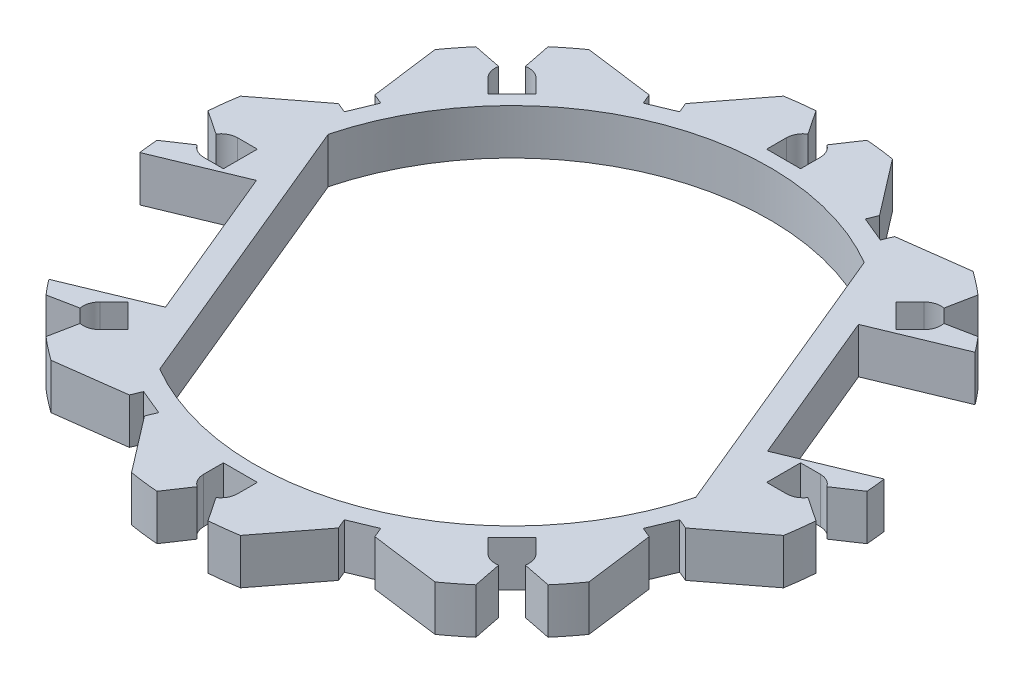
from build123d import *

# Parameters (mm, degrees)
SKETCH1_R           = 54.55
BOSS_EXTRUDE1_DEPTH = 7.5
SKETCH2_R           = 42.5
CUT_EXTRUDE1_DEPTH  = 78.509063986
CUT_EXTRUDE2_DEPTH  = 78.509063986
CUT_EXTRUDE6_DEPTH  = 78.509063986
CIRPATTERN1_COUNT   = 8
CIRPATTERN2_COUNT   = 8
CUT_EXTRUDE7_DEPTH  = 78.279736538
BOSS_EXTRUDE2_DEPTH = 7.5


with BuildPart() as part:
    # Sketch1 → Boss-Extrude1 (new body)
    with BuildSketch(Plane(origin=(0, 0, 0), x_dir=(1, 0, 0), z_dir=(0, 1, 0))):
        with Locations(Location((0, 0, 0), (0, 0, 270))):
            Circle(SKETCH1_R)
    extrude(amount=BOSS_EXTRUDE1_DEPTH)

    # Sketch2 → Cut-Extrude1 (cut, through all)
    with BuildSketch(Plane(origin=(0, 7.5, 0), x_dir=(1, 0, 0), z_dir=(0, 1, 0))):
        with Locations(Location((0, 0, 0), (0, 0, 270))):
            Circle(SKETCH2_R)
    extrude(amount=-CUT_EXTRUDE1_DEPTH, mode=Mode.SUBTRACT)

    # Sketch3 → Cut-Extrude2 (cut, through all)
    with BuildSketch(Plane(origin=(0, 7.5, 0), x_dir=(1, 0, 0), z_dir=(0, 1, 0))):
        with BuildLine():
            Line((-2.8, -48.082), (-2.8, -44.832))
            Line((-2.8, -44.832), (2.8, -44.832))
            Line((2.8, -44.832), (2.8, -48.082))
            ThreePointArc((2.8, -48.082), (2.46937954, -49.401910863), (1.555596652, -50.410114914))
            Line((1.555596652, -50.410114914), (4.212915889, -54.387074197))
            ThreePointArc((4.212915889, -54.387074197), (0, -54.55), (-4.212915889, -54.387074197))
            Line((-4.212915889, -54.387074197), (-1.555596652, -50.410114914))
            ThreePointArc((-1.555596652, -50.410114914), (-2.46937954, -49.401910863), (-2.8, -48.082))
        make_face()
    cut_extrude2 = extrude(amount=-CUT_EXTRUDE2_DEPTH, mode=Mode.SUBTRACT)

    # Sketch9 → Cut-Extrude6 (cut, through all)
    with BuildSketch(Plane(origin=(0, 7.5, 0), x_dir=(1, 0, 0), z_dir=(0, 1, 0))):
        with BuildLine():
            Line((-20.257229317, -42.895088115), (-31.690865911, -44.400354929))
            ThreePointArc((-31.690865911, -44.400354929), (-20.875381236, -50.397628498), (-8.98696587, -53.804618245))
            Line((-8.98696587, -53.804618245), (-16.007383468, -44.655431904))
            Line((-16.007383468, -44.655431904), (-15.318553289, -42.992448745))
            Line((-15.318553289, -42.992448745), (-19.568399139, -41.232104956))
            Line((-19.568399139, -41.232104956), (-20.257229317, -42.895088115))
        make_face()
    cut_extrude6 = extrude(amount=-CUT_EXTRUDE6_DEPTH, mode=Mode.SUBTRACT)

    # CirPattern1: Cut-Extrude2 ×8 about axis
    cirpattern1_axis = Axis((0, 0, 0), (0, 1, 0))
    for i in range(1, CIRPATTERN1_COUNT):
        add(cut_extrude2.rotate(cirpattern1_axis, i * 360 / CIRPATTERN1_COUNT), mode=Mode.SUBTRACT)

    # CirPattern2: Cut-Extrude6 ×8 about axis, 2 skipped
    cirpattern2_axis = Axis((0, 10.872185225, 0), (0, -1, 0))
    add([cut_extrude6.rotate(cirpattern2_axis, i * 360 / CIRPATTERN2_COUNT) for i in range(1, CIRPATTERN2_COUNT) if i not in (1, 5)], mode=Mode.SUBTRACT)

    # Sketch10 → Cut-Extrude7 (cut, through all)
    with BuildSketch(Plane.XZ):
        Polygon((-42.422842704, 2.559768914), (-31.807509711, 28.187449796), (-46.056303911, 34.089493601), (-56.671636904, 8.461812719), align=None)
    cut_extrude7 = extrude(amount=-CUT_EXTRUDE7_DEPTH, mode=Mode.SUBTRACT)

    # Sketch11 → Boss-Extrude2 (add, through all)
    with BuildSketch(Plane.XZ):
        with BuildLine():
            Line((-42.422842704, 2.559768914), (-40.442805118, 1.739610492))
            Line((-40.442805118, 1.739610492), (-29.827472125, 27.367291374))
            Line((-29.827472125, 27.367291374), (-31.807509711, 28.187449796))
            ThreePointArc((-31.807509711, 28.187449796), (-26.965878836, 32.849526307), (-21.449800959, 36.689999166))
            Line((-21.449800959, 36.689999166), (-41.111046925, -10.776447499))
            ThreePointArc((-41.111046925, -10.776447499), (-42.295878596, -4.160367025), (-42.422842704, 2.559768914))
        make_face()
    boss_extrude2 = extrude(amount=-BOSS_EXTRUDE2_DEPTH)

    # Mirror1: Cut-Extrude7, Boss-Extrude2 across plane
    add(cut_extrude7.mirror(Plane(origin=(0, 0, 0), x_dir=(0.38268343236508123, 0, 0.9238795325112903), z_dir=(0.9238795325112903, 0, -0.38268343236508123))), mode=Mode.SUBTRACT)
    add(boss_extrude2.mirror(Plane(origin=(0, 0, 0), x_dir=(0.38268343236508123, 0, 0.9238795325112903), z_dir=(0.9238795325112903, 0, -0.38268343236508123))))


solid = part.part
